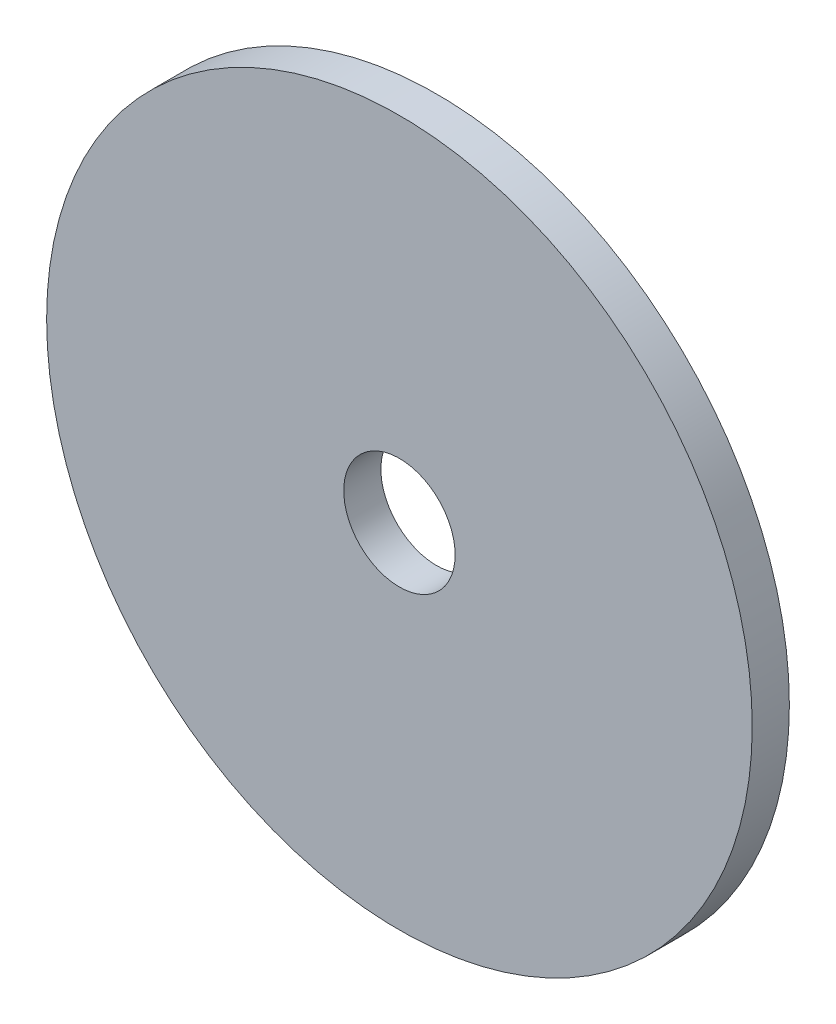
from build123d import *

# Parameters (mm, degrees)
CROQUIS1_R              = 9.5
SALIENTE_EXTRUIR1_DEPTH = 1
CROQUIS2_R              = 1.5
CORTAR_EXTRUIR1_DEPTH   = 1


with BuildPart() as part:
    # Croquis1 → Saliente-Extruir1 (new body)
    with BuildSketch(Plane.XY):
        Circle(CROQUIS1_R)
    extrude(amount=SALIENTE_EXTRUIR1_DEPTH)

    # Croquis2 → Cortar-Extruir1 (cut)
    with BuildSketch(Plane.XY.offset(1)):
        Circle(CROQUIS2_R)
    extrude(amount=-CORTAR_EXTRUIR1_DEPTH, mode=Mode.SUBTRACT)


solid = part.part
